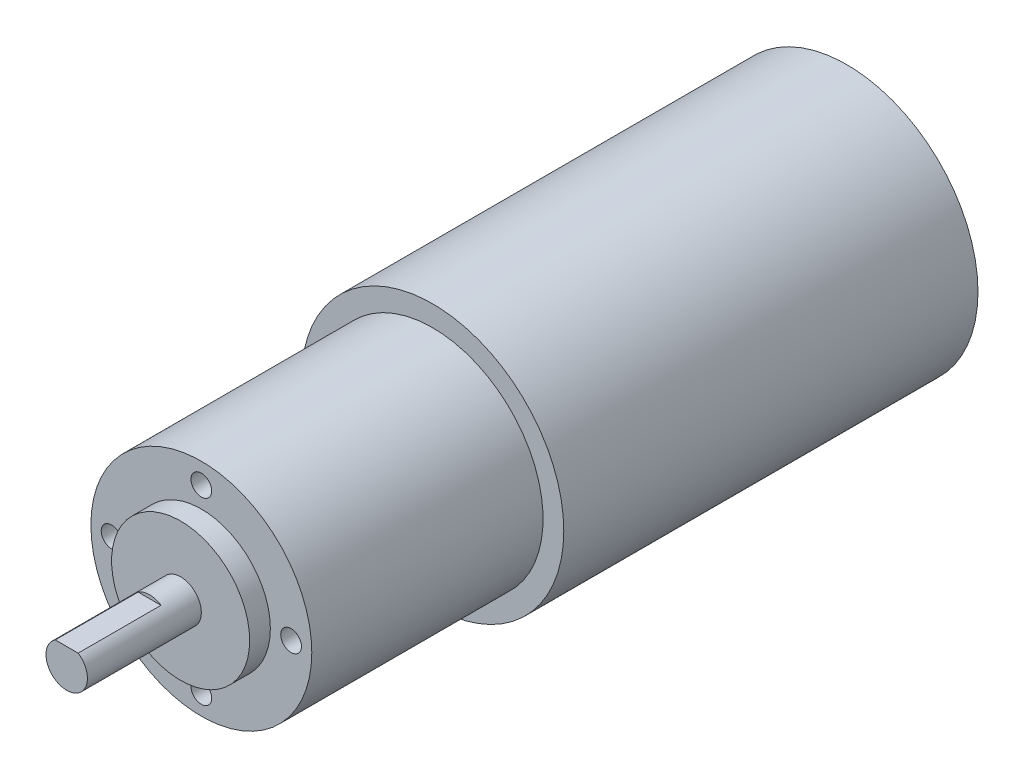
from build123d import *

# Parameters (mm, degrees)
SKETCH_1_R          = 16
EXTRUDE_1_DEPTH     = 33.5
SKETCH_2_R          = 10
EXTRUDE_2_DEPTH     = 3
SKETCH_3_R          = 3
EXTRUDE_3_DEPTH     = 16.5
CUT_EXTRUDE_START   = 3
SKETCH_4_W          = 9.243576196
SKETCH_4_H          = 12
CUT_EXTRUDE_1_DEPTH = 0.5
SKETCH_5_R          = 19
EXTRUDE_4_DEPTH     = 60
SKETCH_6_R          = 1.5
CUT_EXTRUDE_2_DEPTH = 5


with BuildPart() as part:
    # ｽｹｯﾁ1 → ﾎﾞｽ - 押し出し1 (new body)
    with BuildSketch(Plane.XY):
        Circle(SKETCH_1_R)
    extrude(amount=EXTRUDE_1_DEPTH)

    # ｽｹｯﾁ2 → ﾎﾞｽ - 押し出し2 (add)
    with BuildSketch(Plane.XY.offset(33.5)):
        Circle(SKETCH_2_R)
    extrude(amount=EXTRUDE_2_DEPTH)

    # ｽｹｯﾁ3 → ﾎﾞｽ - 押し出し3 (add)
    with BuildSketch(Plane.XY.offset(36.5)):
        Circle(SKETCH_3_R)
    extrude(amount=EXTRUDE_3_DEPTH)

    # ｽｹｯﾁ4 → ｶｯﾄ - 押し出し1 (cut)
    with BuildSketch(Plane(origin=(0, 0, 0), x_dir=(1, 0, 0), z_dir=(0, 1, 0)).offset(CUT_EXTRUDE_START)):
        with Locations((0, -47)):
            Rectangle(SKETCH_4_W, SKETCH_4_H)
    extrude(amount=-CUT_EXTRUDE_1_DEPTH, mode=Mode.SUBTRACT)

    # ｽｹｯﾁ5 → ﾎﾞｽ - 押し出し4 (add)
    with BuildSketch(Plane(origin=(0, 0, 0), x_dir=(-1, 0, 0), z_dir=(0, 0, -1))):
        Circle(SKETCH_5_R)
    extrude(amount=EXTRUDE_4_DEPTH)

    # ｽｹｯﾁ6 → ｶｯﾄ - 押し出し2 (cut)
    with BuildSketch(Plane.XY.offset(33.5)):
        with Locations((0, 13)):
            Circle(SKETCH_6_R)
        with Locations((-13, 0)):
            Circle(SKETCH_6_R)
        with Locations(Location((13, 0, 0), (0, 0, 180))):
            Circle(SKETCH_6_R)
        with Locations(Location((0, -13, 0), (0, 0, 180))):
            Circle(SKETCH_6_R)
    extrude(amount=-CUT_EXTRUDE_2_DEPTH, mode=Mode.SUBTRACT)


solid = part.part
